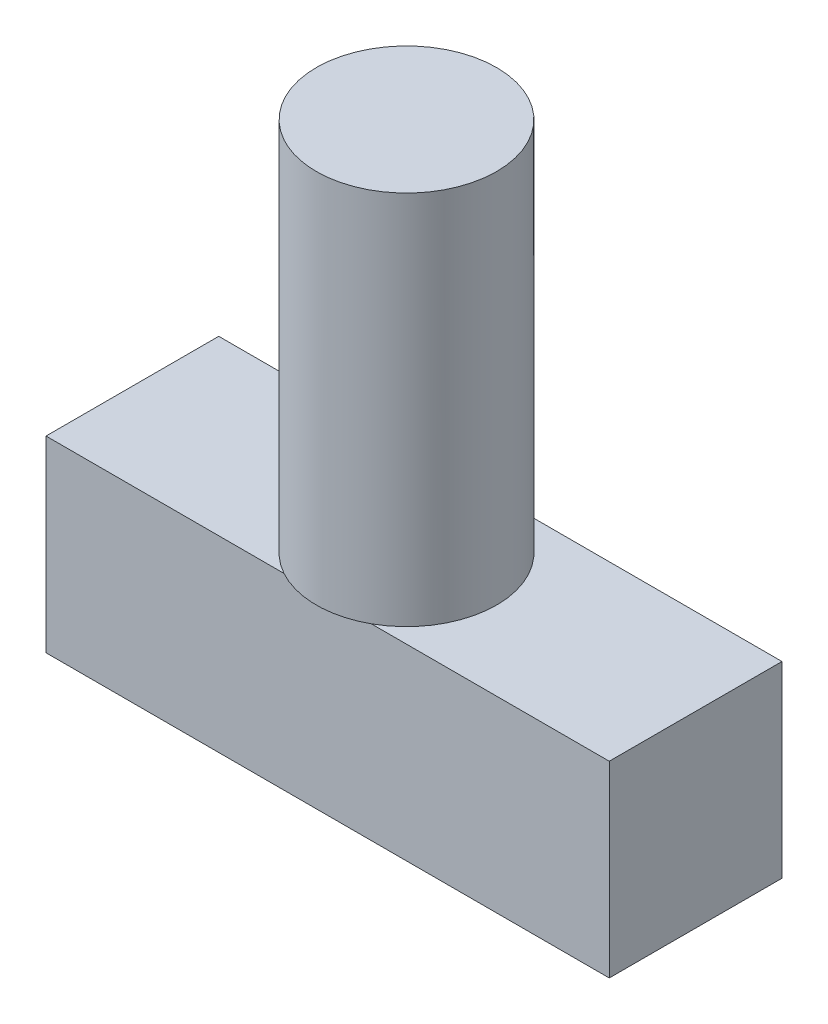
from build123d import *

# Parameters (mm, degrees)
SKETCH1_W           = 15
SKETCH1_H           = 4.6
BOSS_EXTRUDE1_DEPTH = 5
SKETCH2_R           = 2.4
BOSS_EXTRUDE2_DEPTH = 10


with BuildPart() as part:
    # Sketch1 → Boss-Extrude1 (new body)
    with BuildSketch(Plane(origin=(0, 0, 0), x_dir=(1, 0, 0), z_dir=(0, 1, 0))):
        with Locations((0, 0.2)):
            Rectangle(SKETCH1_W, SKETCH1_H)
    extrude(amount=BOSS_EXTRUDE1_DEPTH)

    # Sketch2 → Boss-Extrude2 (add)
    with BuildSketch(Plane(origin=(0, 5, 0), x_dir=(1, 0, 0), z_dir=(0, 1, 0))):
        with Locations(Location((0, 0, 0), (0, 0, 241.044975628))):
            Circle(SKETCH2_R)
    extrude(amount=BOSS_EXTRUDE2_DEPTH)


solid = part.part
